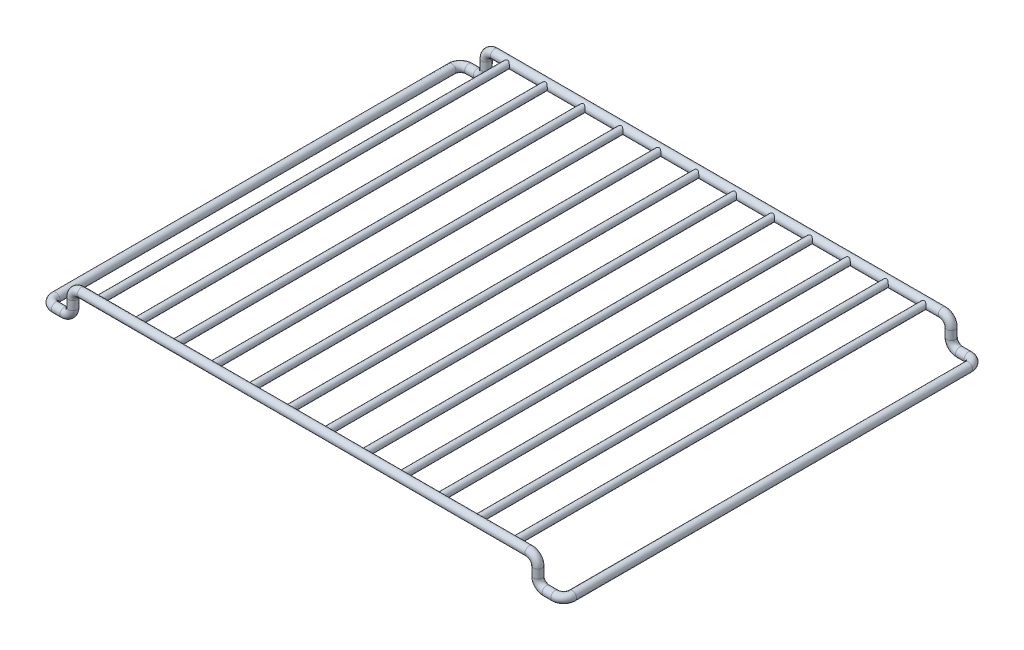
from build123d import *

# Parameters (mm, degrees)
SKETCH1_R                = 2.5
BOSS_EXTRUDE2_REACH      = 289
BOSS_EXTRUDE2_END_RADIUS = 2.5
SKETCH2_R                = 2
LPATTERN1_COUNT          = 6
LPATTERN1_PITCH          = 22


with BuildPart() as part:
    # Sweep1: sweep along a curve in space
    with BuildLine() as sweep1_path:
        Line((0, 0, 0), (130, 0, 0))
        ThreePointArc((130, 0, 0), (133.535533906, -1.464466094, 0), (135, -5, 0))
        Line((135, -5, 0), (135, -10, 0))
        ThreePointArc((135, -10, 0), (136.464466094, -13.535533906, 0), (140, -15, 0))
        Line((140, -15, 0), (145, -15, 0))
        ThreePointArc((145, -15, 0), (148.535533906, -15, -1.464466094), (150, -15, -5))
        Line((150, -15, -5), (150, -15, -235))
        ThreePointArc((150, -15, -235), (148.535533906, -15, -238.535533906), (145, -15, -240))
        Line((145, -15, -240), (140, -15, -240))
        ThreePointArc((140, -15, -240), (136.464466094, -13.535533906, -240), (135, -10, -240))
        Line((135, -10, -240), (135, -5, -240))
        ThreePointArc((135, -5, -240), (133.535533906, -1.464466094, -240), (130, 0, -240))
        Line((130, 0, -240), (0, 0, -240))
    # Sketch1 → Sweep1 (sweep)
    with BuildSketch(Plane(origin=(0, 0, 0), x_dir=(0, 0, -1), z_dir=(1, 0, 0))):
        Circle(SKETCH1_R)
    sweep(path=sweep1_path.line)

    # Boss-Extrude2: up to this cylinder (the profile starts outside it)
    boss_extrude2_end = Plane(origin=(11, 0, -240), z_dir=(-1, 0, 0)) * Cylinder(BOSS_EXTRUDE2_END_RADIUS, 584, mode=Mode.PRIVATE)
    # Sketch2 → Boss-Extrude2 (add, up to the surface)
    with BuildSketch(Plane.XY, mode=Mode.PRIVATE) as boss_extrude2_sk1:
        with Locations((11, 0)):
            Circle(SKETCH2_R)
    boss_extrude2_tool1 = extrude(boss_extrude2_sk1.sketch, amount=-BOSS_EXTRUDE2_REACH, mode=Mode.PRIVATE) - boss_extrude2_end
    boss_extrude2 = boss_extrude2_tool1.solids().sort_by_distance((11, 0, 0))[0]
    add(boss_extrude2)

    # LPattern1: Boss-Extrude2 ×6
    with Locations(*[(i * LPATTERN1_PITCH, 0, 0) for i in range(1, LPATTERN1_COUNT)]):
        add(boss_extrude2)

    # Mirror1: part across plane


with BuildPart() as part_1:
    add(part.part)
    add(part.part.mirror(Plane(origin=(0, 0, 0), x_dir=(0, 0, 1), z_dir=(1, 0, 0))))


solid = part_1.part
